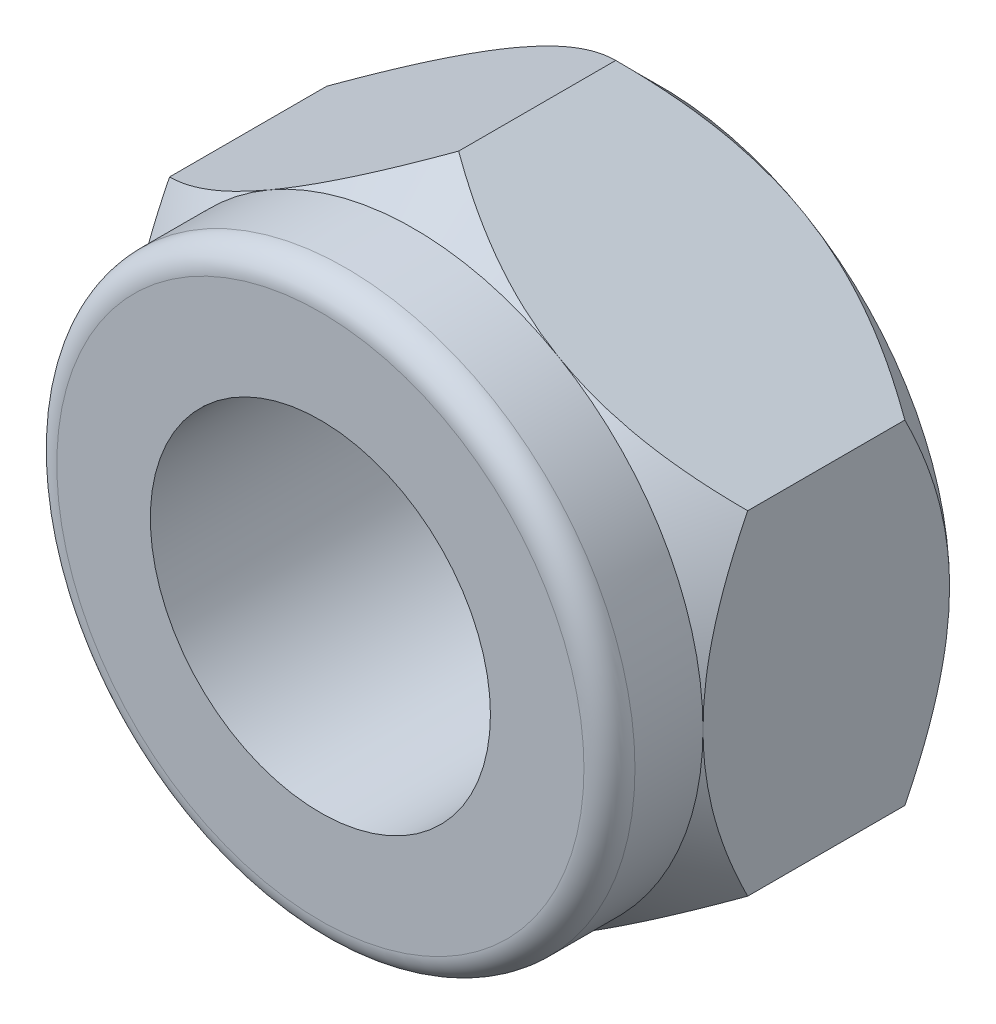
from build123d import *

# Parameters (mm, degrees)
EXTRUDE_1_DEPTH      = 2.9
SKETCH_2_R           = 3.4
EXTRUDE_2_DEPTH      = 1.1
SKETCH_3_R           = 2
CUT_EXTRUDE_1_DEPTH  = 7.555404895
SKETCH_2_2_OUTSIDE_W = 13.226
SKETCH_2_2_OUTSIDE_H = 14.278
SKETCH_2_2_OUTSIDE_R = 3.4
CUT_EXTRUDE_2_DEPTH  = 1.1
CUT_EXTRUDE_2_DRAFT  = -45
SKETCH_4_OUTSIDE_W   = 13.226
SKETCH_4_OUTSIDE_H   = 14.278
SKETCH_4_OUTSIDE_R   = 3.4
CUT_EXTRUDE_3_DEPTH  = 1.1
CUT_EXTRUDE_3_DRAFT  = -45
FILLET_1_R           = 0.3


with BuildPart() as part:
    # 草图1 → 凸台-拉伸1 (new body)
    with BuildSketch(Plane.XY):
        Polygon((0, 3.92598183), (-3.4, 1.962990915), (-3.4, -1.962990915), (0, -3.92598183), (3.4, -1.962990915), (3.4, 1.962990915), align=None)
    extrude(amount=EXTRUDE_1_DEPTH)

    # 草图2 → 凸台-拉伸2 (add)
    with BuildSketch(Plane.XY.offset(2.9)):
        Circle(SKETCH_2_R)
    extrude(amount=EXTRUDE_2_DEPTH)

    # 草图3 → 切除-拉伸1 (cut, through all)
    with BuildSketch(Plane.XY.offset(4)):
        Circle(SKETCH_3_R)
    extrude(amount=-CUT_EXTRUDE_1_DEPTH, mode=Mode.SUBTRACT)


with BuildPart() as cut_extrude_2_tool:
    # 草图2<2> outside → 切除-拉伸2 (with draft: the straight prism first)
    with BuildSketch(Plane.XY.offset(2.9)):
        Rectangle(SKETCH_2_2_OUTSIDE_W, SKETCH_2_2_OUTSIDE_H)
        Circle(SKETCH_2_2_OUTSIDE_R, mode=Mode.SUBTRACT)
    extrude(amount=-CUT_EXTRUDE_2_DEPTH)
    # 切除-拉伸2: the draft: its side faces are tilted about the plane it starts from
    cut_extrude_2_sides = [cut_extrude_2_tool.faces().sort_by_distance(p)[0] for p in [
        (0, -7.139, 2.35),
        (6.613, 0, 2.35),
        (0, 7.139, 2.35),
        (-6.613, 0, 2.35),
        (-3.4, 0, 2.35),
    ]]
    draft(cut_extrude_2_sides, Plane.XY.offset(2.9), CUT_EXTRUDE_2_DRAFT)


with BuildPart() as part_1:
    add(part.part)

    # 切除-拉伸2: cut by cut_extrude_2_tool
    add(cut_extrude_2_tool.part, mode=Mode.SUBTRACT)


with BuildPart() as cut_extrude_3_tool:
    # 草图4 outside → 切除-拉伸3 (with draft: the straight prism first)
    with BuildSketch(Plane(origin=(0, 0, 0), x_dir=(-1, 0, 0), z_dir=(0, 0, -1))):
        Rectangle(SKETCH_4_OUTSIDE_W, SKETCH_4_OUTSIDE_H)
        Circle(SKETCH_4_OUTSIDE_R, mode=Mode.SUBTRACT)
    extrude(amount=-CUT_EXTRUDE_3_DEPTH)
    # 切除-拉伸3: the draft: its side faces are tilted about the plane it starts from
    cut_extrude_3_sides = [cut_extrude_3_tool.faces().sort_by_distance(p)[0] for p in [
        (0, -7.139, 0.55),
        (-6.613, 0, 0.55),
        (0, 7.139, 0.55),
        (6.613, 0, 0.55),
        (3.4, 0, 0.55),
    ]]
    draft(cut_extrude_3_sides, Plane(origin=(0, 0, 0), x_dir=(-1, 0, 0), z_dir=(0, 0, -1)), CUT_EXTRUDE_3_DRAFT)


with BuildPart() as part_2:
    add(part_1.part)

    # 切除-拉伸3: cut by cut_extrude_3_tool
    add(cut_extrude_3_tool.part, mode=Mode.SUBTRACT)

    # 圆角1
    fillet_1_edges = [part_2.edges().sort_by_distance(p)[0] for p in [
        (-3.4, 0, 4),
    ]]
    fillet(fillet_1_edges, radius=FILLET_1_R)


solid = part_2.part
